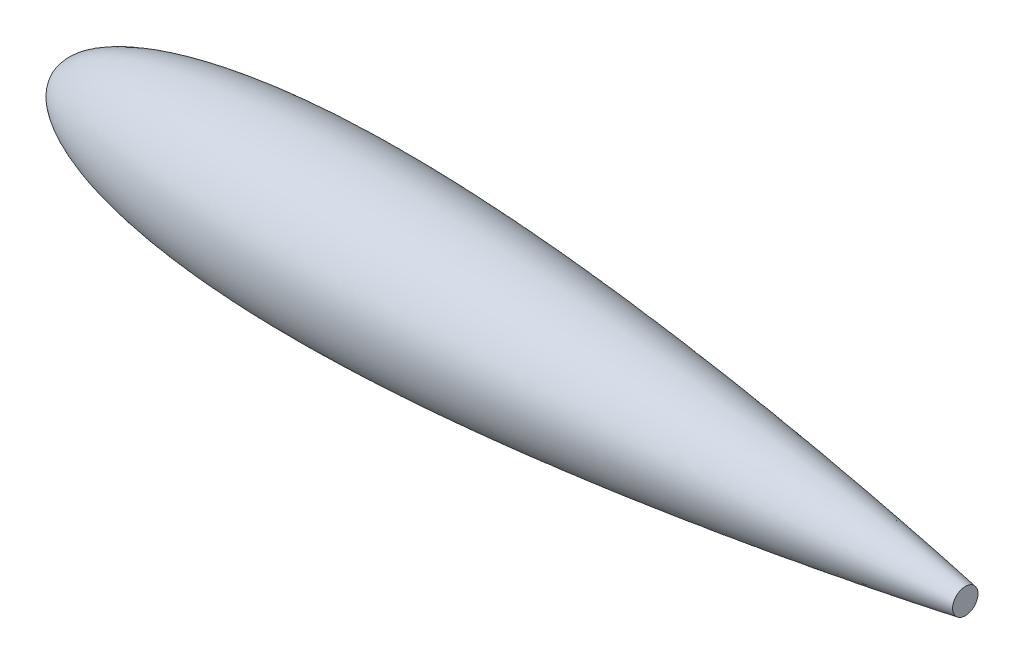
from build123d import *

# Parameters (mm, degrees)
CUT_EXTRUDE1_START = 700
SKETCH5_R          = 55
CUT_EXTRUDE1_DEPTH = 50


with BuildPart() as part:
    # Sketch3 → Revolve1 (revolve)
    with BuildSketch(Plane.XY):
        with BuildLine():
            Line((0, 0), (700, 0))
            add(Edge.make_bspline(
                [(0, 0), (-0.000260822, 0.812598679), (0.0768092, 2.159414211), (0.376715029, 4.098181065), (1.123718167, 6.604276729), (2.138502348, 8.959562617), (3.610559705, 11.50188023), (5.690164051, 14.28676002), (8.676927237, 17.448527265), (13.06262492, 21.137160706), (19.635575261, 25.496572659), (29.470499091, 30.557470394), (44.537843587, 36.438230824), (66.507523387, 42.625870414), (92.546102756, 47.586819511), (121.249691163, 51.207185926), (156.930625872, 54.012905624), (197.4229785, 55.356558664), (244.684921451, 54.935695428), (291.893431334, 52.773929996), (332.299295573, 49.982529373), (365.929618682, 47.133609439), (392.808561015, 44.575609474), (419.662431959, 41.766232142), (446.491196854, 38.728002254), (473.295240639, 35.477934382), (500.074136678, 32.028809996), (523.483904056, 28.843826036), (543.532608643, 25.997506143), (560.229511217, 23.54798946), (573.578572291, 21.542099671), (586.923625352, 19.488688155), (600.255716727, 17.388859228), (613.589671532, 15.238968456), (626.89906753, 13.04302131), (638.564267484, 11.072393618), (648.514486611, 9.359153021), (656.870951289, 7.896402098), (663.430739751, 6.736201721), (670.238919, 5.514631525), (676.5947433, 4.364833522), (683.719860131, 3.054031138), (689.533934487, 1.97793371), (695.548172643, 0.844768017), (698.491610118, 0.287105853), (700, 0)],
                knots=[0, 0, 0, 0, 0, 0.004089771, 0.006806116, 0.009858411, 0.013161723, 0.016997005, 0.021591856, 0.02735242, 0.035054996, 0.045843846, 0.06129632, 0.083042589, 0.11651461, 0.160814682, 0.194864372, 0.228914062, 0.297013453, 0.365112846, 0.43321224, 0.467261938, 0.501311635, 0.535361333, 0.56941103, 0.603460727, 0.637510423, 0.671560121, 0.705609819, 0.722634668, 0.739659517, 0.756684365, 0.773709214, 0.790734063, 0.807758911, 0.824783759, 0.841808608, 0.850321032, 0.858833457, 0.867345881, 0.875858306, 0.884370731, 0.892883155, 0.90139558, 0.909908004, 0.909908004, 0.909908004, 0.909908004, 0.909908004], degree=4))
        make_face()
    revolve(axis=Axis((0, 0, 0), (1, 0, 0)))

    # Sketch5 → Cut-Extrude1 (cut)
    with BuildSketch(Plane(origin=(0, 0, 0), x_dir=(0, 0, -1), z_dir=(1, 0, 0)).offset(CUT_EXTRUDE1_START)):
        Circle(SKETCH5_R)
    extrude(amount=-CUT_EXTRUDE1_DEPTH, mode=Mode.SUBTRACT)


solid = part.part
